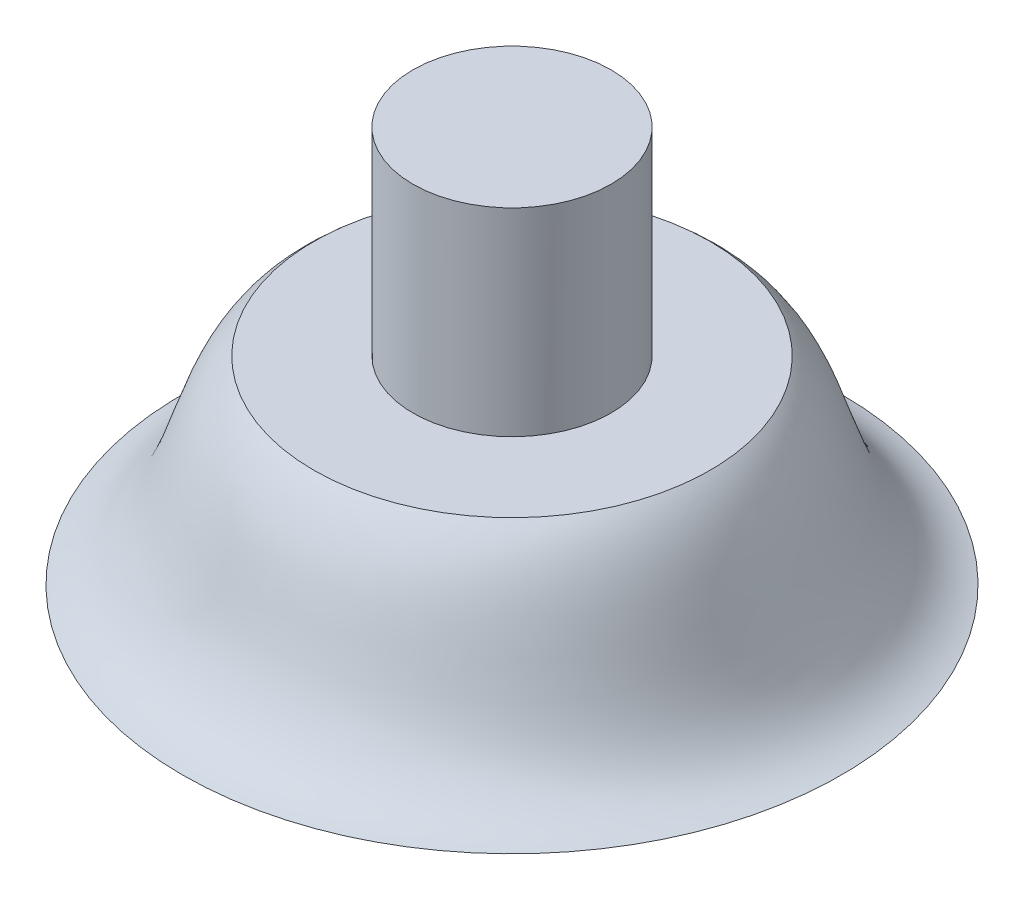
from build123d import *

# Parameters (mm, degrees)
ESQUISSE2_R        = 5
BOSS_EXTRU_1_DEPTH = 10


with BuildPart() as part:
    # Esquisse1 one side → Révolution2 (revolve)
    with BuildSketch(Plane.XY):
        with BuildLine():
            Line((16.628532392, 4.701265773), (16.628532392, -5.298734227))
            Line((16.628532392, -5.298734227), (33.257064783, -5.298734227))
            add(Edge.make_bspline(
                [(33.257064783, -5.298734227), (28.785635181, -4.230639153), (29.676657005, 2.186628343), (26.628532392, 4.701265773)],
                knots=[0, 0, 0, 0, 1, 1, 1, 1], degree=3))
            Line((26.628532392, 4.701265773), (21.628532392, 4.701265773))
            Line((21.628532392, 4.701265773), (16.628532392, 4.701265773))
        make_face()
    revolve(axis=Axis((16.628532392, 4.701265773, 0), (0, -1, 0)))

    # Esquisse2 → Boss.-Extru.1 (add)
    with BuildSketch(Plane(origin=(0, 4.701265773, 0), x_dir=(1, 0, 0), z_dir=(0, 1, 0))):
        with Locations(Location((16.628532392, 0, 0), (0, 0, 90))):
            Circle(ESQUISSE2_R)
    extrude(amount=BOSS_EXTRU_1_DEPTH)


solid = part.part
